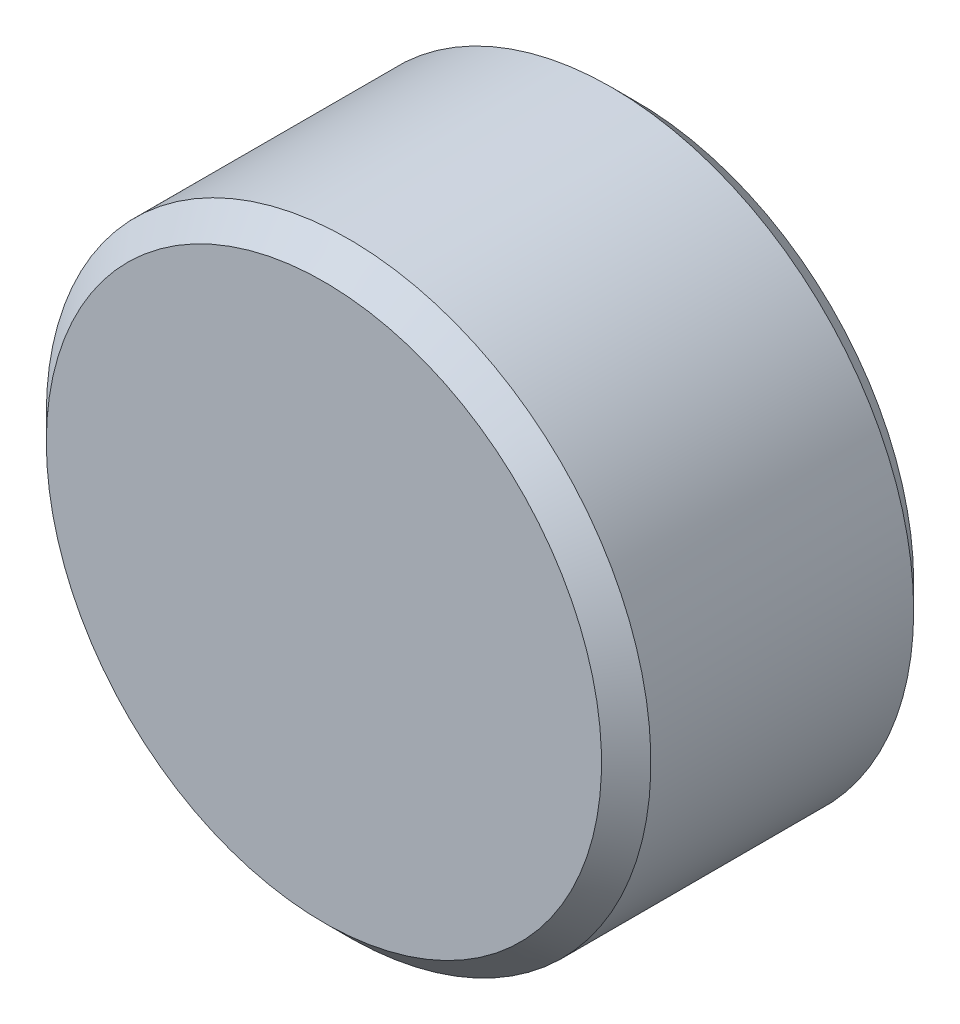
from build123d import *

# Parameters (mm, degrees)
SKETCH1_R           = 6.223
BOSS_EXTRUDE1_DEPTH = 6.4262
CHAMFER1_SIZE       = 0.508


with BuildPart() as part:
    # Sketch1 → Boss-Extrude1 (new body)
    with BuildSketch(Plane.XY):
        with Locations(Location((0, 0, 0), (0, 0, 180))):
            Circle(SKETCH1_R)
    extrude(amount=BOSS_EXTRUDE1_DEPTH)

    # Chamfer1
    chamfer1_edges = [part.edges().sort_by_distance(p)[0] for p in [
        (6.223, 0, 0),
        (6.223, 0, 6.4262),
    ]]
    chamfer(chamfer1_edges, length=CHAMFER1_SIZE)


solid = part.part
